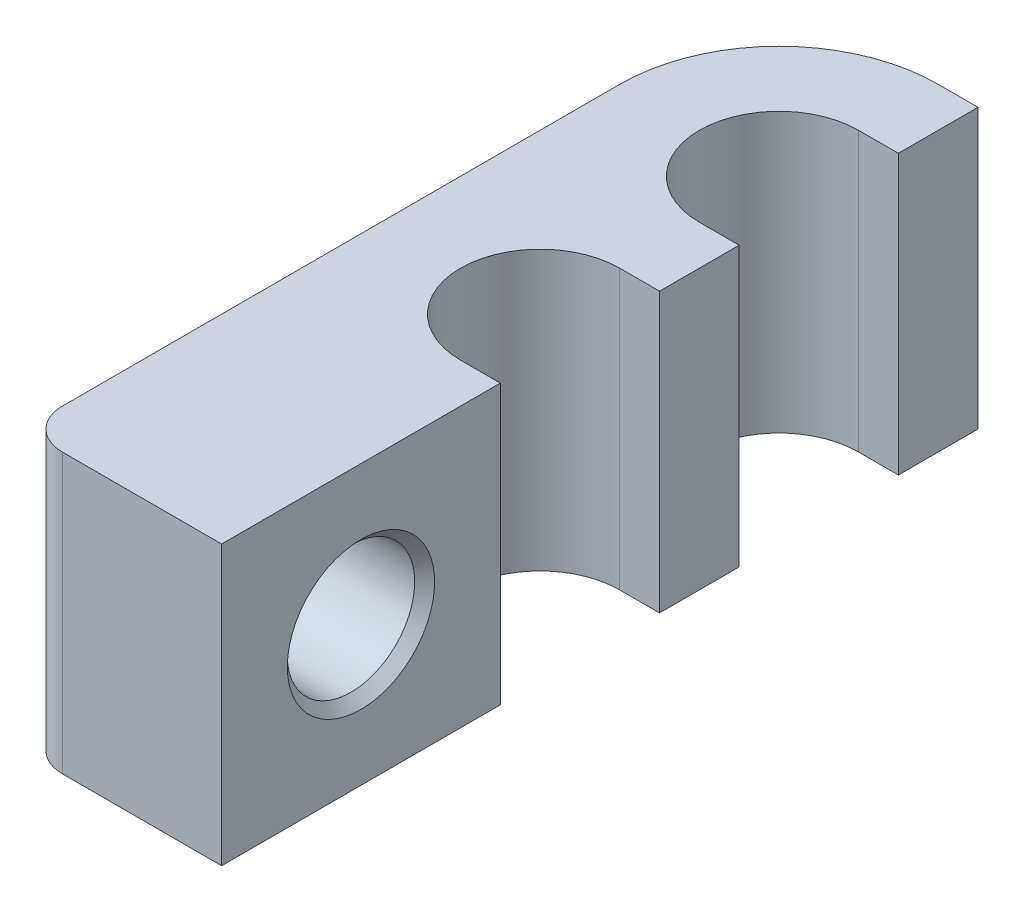
from build123d import *

# Parameters (mm, degrees)
BOSS_EXTRUDE1_DEPTH  = 7
M3_CLEARANCE_HOLE1_D = 3.2
CHAMFER2_SIZE        = 0.25
FILLET1_R            = 1


with BuildPart() as part:
    # Sketch1 → Boss-Extrude1 (new body)
    with BuildSketch(Plane(origin=(0, 0, 0), x_dir=(1, 0, 0), z_dir=(0, 1, 0))):
        with BuildLine():
            Line((0, 0), (-5, 0))
            Line((-5, 0), (-5, 9))
            Line((-5, 9), (-5, 15))
            ThreePointArc((-5, 15), (-3.828427125, 17.828427125), (-1, 19))
            Line((-1, 19), (0, 19))
            Line((0, 19), (0, 17))
            Line((0, 17), (-1, 17))
            ThreePointArc((-1, 17), (-3, 15), (-1, 13))
            Line((-1, 13), (0, 13))
            Line((0, 13), (0, 11))
            Line((0, 11), (-1, 11))
            ThreePointArc((-1, 11), (-3, 9), (-1, 7))
            Line((-1, 7), (0, 7))
            Line((0, 7), (0, 0))
        make_face()
    extrude(amount=BOSS_EXTRUDE1_DEPTH)

    # M3 Clearance Hole1 (through all)
    with Locations(Plane.ZY.offset(5)):
        with Locations((-3.5, 3.5)):
            Hole(M3_CLEARANCE_HOLE1_D / 2)

    # Chamfer2
    chamfer2_edges = [part.edges().sort_by_distance(p)[0] for p in [
        (-5, 3.5, -1.9),
        (0, 3.5, -1.9),
    ]]
    chamfer(chamfer2_edges, length=CHAMFER2_SIZE)

    # Fillet1
    fillet1_edges = [part.edges().sort_by_distance(p)[0] for p in [
        (-5, 3.5, 0),
    ]]
    fillet(fillet1_edges, radius=FILLET1_R)


solid = part.part
